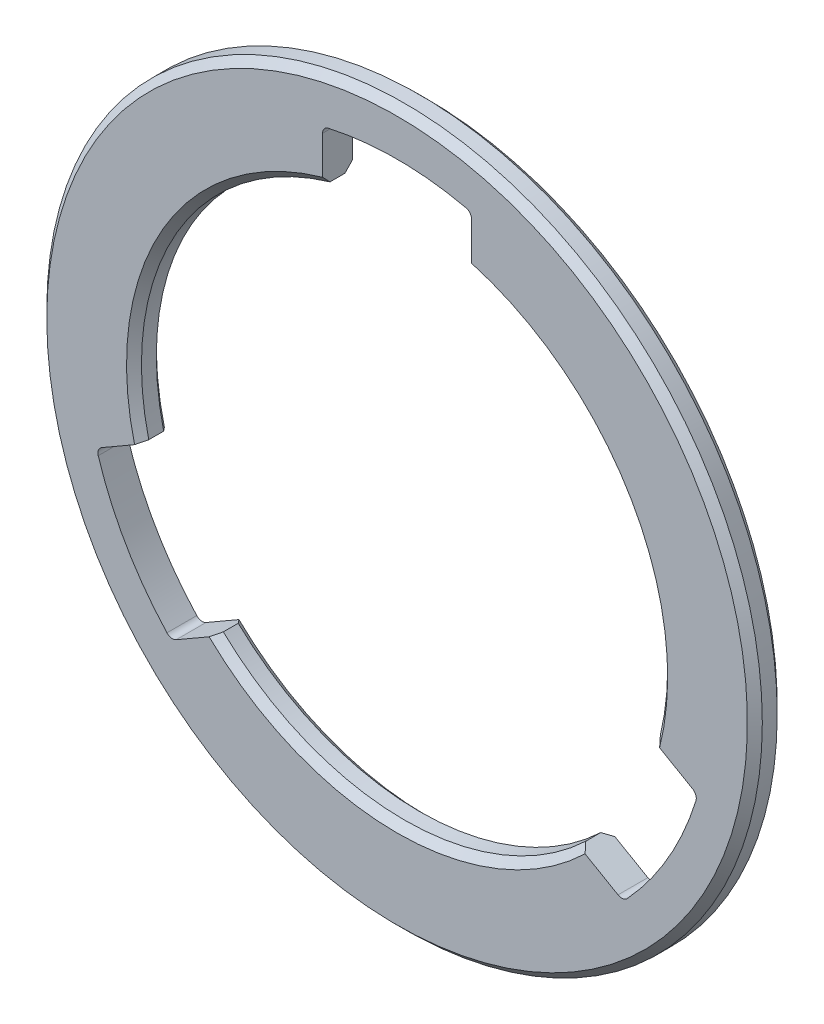
from build123d import *

# Parameters (mm, degrees)
SKETCH23_R               = 24
SKETCH23_R_2             = 17.5
BOSS_EXTRUDE3_DEPTH      = 2
MOVE_FACE1_BY            = 0.15
CHAMFER2_SIZE            = 0.5
CUT_EXTRUDE3_DEPTH       = 2
FILLET1_R                = 0.5
CIRPATTERN1_COUNT        = 3
FILLET1_OF_CIRPATTERN1_R = 0.5


with BuildPart() as part:
    # Sketch23 → Boss-Extrude3 (new body)
    with BuildSketch(Plane(origin=(0, 0, 0), x_dir=(-1, 0, 0), z_dir=(0, 0, -1))):
        Circle(SKETCH23_R)
        Circle(SKETCH23_R_2, mode=Mode.SUBTRACT)
    extrude(amount=-BOSS_EXTRUDE3_DEPTH)

    # Move Face1: a curved face moved inward by 0.15
    add(Solid.thicken(part.faces().sort_by_distance((17.5, 0, 1))[0], -MOVE_FACE1_BY), mode=Mode.SUBTRACT)

    # Chamfer2
    chamfer2_edges = [part.edges().sort_by_distance(p)[0] for p in [
        (24, 0, 0),
        (24, 0, 2),
        (17.65, 0, 2),
        (17.65, 0, 0),
    ]]
    chamfer(chamfer2_edges, length=CHAMFER2_SIZE)

    # Sketch24 → Cut-Extrude3 (cut)
    with BuildSketch(Plane(origin=(0, 0, 0), x_dir=(-1, 0, 0), z_dir=(0, 0, -1))):
        with BuildLine():
            Line((-5, 20.396078054), (-5, 16.926975512))
            ThreePointArc((-5, 16.926975512), (0, 17.65), (5, 16.926975512))
            Line((5, 16.926975512), (5, 20.396078054))
            ThreePointArc((5, 20.396078054), (0, 21), (-5, 20.396078054))
        make_face()
    cut_extrude3 = extrude(amount=-CUT_EXTRUDE3_DEPTH, mode=Mode.SUBTRACT)

    # Fillet1
    fillet1_edges = [part.edges().sort_by_distance(p)[0] for p in [
        (5, 20.396078054, 1),
        (-5, 20.396078054, 1),
    ]]
    fillet(fillet1_edges, radius=FILLET1_R)

    # CirPattern1: Cut-Extrude3 ×3 about axis
    cirpattern1_axis = Axis((0, 0, 0), (0, 0, 1))
    for i in range(1, CIRPATTERN1_COUNT):
        add(cut_extrude3.rotate(cirpattern1_axis, i * 360 / CIRPATTERN1_COUNT), mode=Mode.SUBTRACT)

    # Fillet1 of CirPattern1
    fillet1_of_cirpattern1_edges = [part.edges().sort_by_distance(p)[0] for p in [
        (-20.163521733, -5.867912008, 1),
        (-15.163521733, -14.528166046, 1),
        (15.163521733, -14.528166046, 1),
        (20.163521733, -5.867912008, 1),
    ]]
    fillet(fillet1_of_cirpattern1_edges, radius=FILLET1_OF_CIRPATTERN1_R)


solid = part.part
